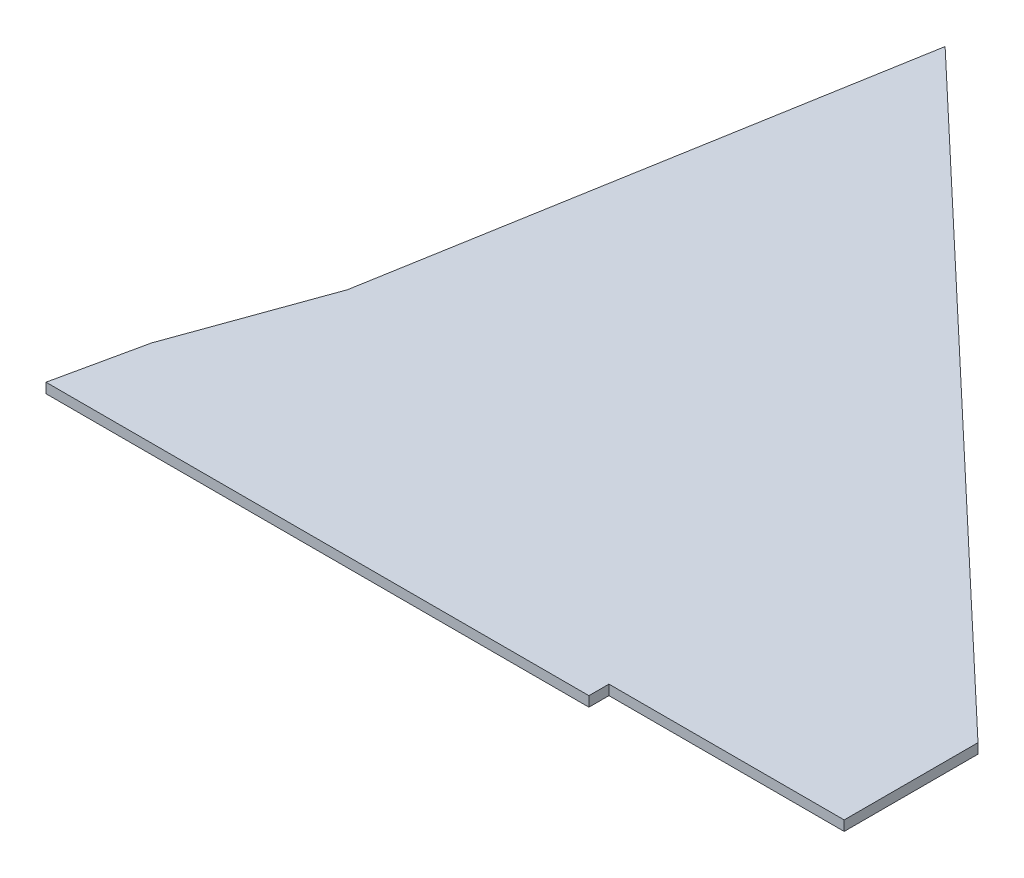
from build123d import *

# Parameters (mm, degrees)
EXTRUDE_2_DEPTH = 1
EXTRUDE_3_DEPTH = 0.2


with BuildPart() as part:
    # 草图1 → 凸台-拉伸2 (new body)
    with BuildSketch(Plane(origin=(0, 0, 0), x_dir=(1, 0, 0), z_dir=(0, 1, 0))):
        Polygon((0.666974339, -2.008736998), (62.551506128, -60.607239608), (62.551506128, -66.034908414), (62.551506128, -67.034908414), (62.551506128, -73.980545843), (39.045516138, -73.980545843), (39.045516138, -75.980545843), (-15.208783188, -75.980545843), (-13.317561286, -67.24653925), (-13.232104006, -67.034908414), (-12.872161474, -66.034908414), (-8.15025235, -52.916400008), align=None)
    extrude(amount=EXTRUDE_2_DEPTH)

    # 草图2 → 凸台-拉伸3 (add)
    # profile 1 of 5: a face of its own
    with BuildSketch(Plane.XZ):
        with BuildLine():
            Line((16.074632356, 56.916400008), (17.590866122, 56.916400008))
            add(Edge.make_bspline(
                [(17.590866122, 56.916400008), (17.648499995, 56.915875197), (17.759747413, 56.914862185), (17.920586306, 56.908759142), (18.068885312, 56.897038009), (18.206653748, 56.882921899), (18.336200791, 56.858115693), (18.459924614, 56.818759177), (18.578616773, 56.764956297), (18.691565149, 56.697511264), (18.796674333, 56.617289158), (18.888130253, 56.521122322), (18.966299174, 56.411973737), (19.028319344, 56.290438449), (19.077510823, 56.161810781), (19.1135732, 56.028909192), (19.135164995, 55.892755975), (19.138096413, 55.800945299), (19.139567421, 55.754874034)],
                knots=[0, 0, 0, 0, 1.244157682, 2.401527469, 3.473468824, 4.455130815, 5.389799171, 6.315206347, 7.251005401, 8.196559236, 9.149855764, 10.095824383, 11.0504261, 12.037874139, 13.032515979, 14.018598527, 15.005718329, 16, 16, 16, 16], degree=3))
            add(Edge.make_bspline(
                [(19.139567421, 55.754874034), (19.138547753, 55.709628614), (19.136549692, 55.62096924), (19.118813235, 55.491715961), (19.091882738, 55.368787174), (19.051654983, 55.253368308), (19.001161623, 55.144377841), (18.939293482, 55.042382161), (18.865381477, 54.94771844), (18.780990114, 54.859539474), (18.683688187, 54.779903763), (18.572291815, 54.711866589), (18.447832517, 54.654005487), (18.309784555, 54.60723217), (18.158146088, 54.570903332), (17.993045434, 54.545819174), (17.814704152, 54.528835116), (17.691287831, 54.527487377), (17.627392096, 54.526789618)],
                knots=[0, 0, 0, 0, 0.978177196, 1.916759246, 2.816858773, 3.695957288, 4.554717961, 5.410842432, 6.270061616, 7.147502833, 8.04596474, 8.981440044, 9.963234339, 11.008881904, 12.128796686, 13.33146493, 14.618432235, 16, 16, 16, 16], degree=3))
            Line((17.627392096, 54.526789618), (16.594112875, 54.526789618))
            Line((16.594112875, 54.526789618), (16.594112875, 52.916400008))
            Line((16.594112875, 52.916400008), (16.074632356, 52.916400008))
            Line((16.074632356, 52.916400008), (16.074632356, 56.916400008))
        make_face()
        with BuildLine():
            Line((16.594112875, 54.994322086), (17.650931057, 54.994322086))
            add(Edge.make_bspline(
                [(17.650931057, 54.994322086), (17.690172766, 54.995061361), (17.766036024, 54.99649055), (17.876167316, 55.004159305), (17.978355079, 55.018842231), (18.073507315, 55.03877464), (18.160686648, 55.06578506), (18.241235048, 55.096684456), (18.312817617, 55.135887532), (18.378661064, 55.177860376), (18.434924498, 55.228732153), (18.485001095, 55.283646875), (18.526862026, 55.345519566), (18.560622639, 55.413088849), (18.588087085, 55.486118776), (18.606105808, 55.565315304), (18.617782876, 55.650090448), (18.619304398, 55.708566601), (18.620086901, 55.738640268)],
                knots=[0, 0, 0, 0, 1.3506626, 2.611141784, 3.796285978, 4.901204962, 5.9527306, 6.934848657, 7.863795126, 8.757347314, 9.614903967, 10.465506862, 11.310023167, 12.176181001, 13.060025945, 13.98827215, 14.965389641, 16, 16, 16, 16], degree=3))
            add(Edge.make_bspline(
                [(18.620086901, 55.738640268), (18.618529753, 55.778259728), (18.615482558, 55.855791318), (18.591468075, 55.968436501), (18.551110872, 56.073679691), (18.496255375, 56.169934719), (18.431237857, 56.254919142), (18.356071863, 56.32257299), (18.274416141, 56.374244346), (18.181156898, 56.405995302), (18.074430539, 56.425089523), (17.949178007, 56.439604071), (17.801715925, 56.446811551), (17.696120516, 56.448150466), (17.639567421, 56.44886754)],
                knots=[0, 0, 0, 0, 1.018660659, 1.99342392, 2.947462538, 3.907551051, 4.834908788, 5.687573627, 6.497006468, 7.302839678, 8.203828931, 9.283092672, 10.544922364, 12, 12, 12, 12], degree=3))
            Line((17.639567421, 56.44886754), (16.594112875, 56.44886754))
            Line((16.594112875, 56.44886754), (16.594112875, 54.994322086))
        make_face(mode=Mode.SUBTRACT)
    # profile 2 of 5: a face of its own
    with BuildSketch(Plane.XZ):
        with BuildLine():
            Line((22.308398589, 52.916400008), (21.78891807, 52.916400008))
            add(Edge.make_bspline(
                [(21.78891807, 52.916400008), (21.771030564, 52.941612159), (21.734192084, 52.993535406), (21.693635699, 53.083848499), (21.656527825, 53.18292137), (21.641087617, 53.254335162), (21.633073914, 53.291400008)],
                knots=[0, 0, 0, 0, 0.903978496, 1.861701424, 2.890190454, 4, 4, 4, 4], degree=3))
            add(Edge.make_bspline(
                [(21.633073914, 53.291400008), (21.592778696, 53.257392964), (21.513514667, 53.190498291), (21.38712942, 53.104367919), (21.25968558, 53.028919474), (21.128130741, 52.970475054), (20.99532114, 52.922034952), (20.859397596, 52.88948097), (20.721160465, 52.86784696), (20.628015769, 52.865588757), (20.581125862, 52.864451956)],
                knots=[0, 0, 0, 0, 1.089286914, 2.142717553, 3.15767242, 4.14639824, 5.114065367, 6.075847107, 7.031363525, 8, 8, 8, 8], degree=3))
            add(Edge.make_bspline(
                [(20.581125862, 52.864451956), (20.544291352, 52.86487426), (20.472597394, 52.865696225), (20.368240679, 52.877883531), (20.269832252, 52.895063243), (20.17747491, 52.920422327), (20.090928869, 52.952787508), (20.010453779, 52.992942768), (19.934887287, 53.03887208), (19.867163958, 53.093579728), (19.805930348, 53.153443277), (19.753293609, 53.218993358), (19.70672904, 53.288102814), (19.670678414, 53.363297978), (19.642000507, 53.442416882), (19.621650322, 53.526218982), (19.609345029, 53.614624874), (19.607857301, 53.675288482), (19.607099888, 53.706172735)],
                knots=[0, 0, 0, 0, 1.216620172, 2.368005272, 3.467709852, 4.515474186, 5.528552914, 6.516295668, 7.48404396, 8.444826962, 9.386953838, 10.308660681, 11.218844643, 12.134633563, 13.056730693, 13.995797328, 14.979646845, 16, 16, 16, 16], degree=3))
            add(Edge.make_bspline(
                [(19.607099888, 53.706172735), (19.607839464, 53.735711316), (19.609297951, 53.793963185), (19.621988656, 53.878979729), (19.641089887, 53.96056233), (19.669748996, 54.037418373), (19.705890994, 54.110590268), (19.74953236, 54.179805691), (19.802506313, 54.244224819), (19.86249956, 54.305855294), (19.933563689, 54.362169995), (20.015053623, 54.414536401), (20.109325366, 54.460390215), (20.21502913, 54.501504264), (20.332261729, 54.537819715), (20.4610338, 54.56929687), (20.601389415, 54.596042543), (20.699288508, 54.609243212), (20.749957031, 54.616075333)],
                knots=[0, 0, 0, 0, 0.872498924, 1.720620716, 2.535170943, 3.344721347, 4.138600393, 4.943834853, 5.75681365, 6.59930027, 7.480948153, 8.430305917, 9.456622844, 10.573255699, 11.779617648, 13.080931191, 14.489210689, 16, 16, 16, 16], degree=3))
            Line((20.749957031, 54.616075333), (21.209372615, 54.685068839))
            add(Edge.make_bspline(
                [(21.209372615, 54.685068839), (21.250547073, 54.692111388), (21.32907039, 54.705542148), (21.441050463, 54.728941183), (21.541471868, 54.755043313), (21.603693773, 54.77643098), (21.633073914, 54.786529878)],
                knots=[0, 0, 0, 0, 1.148822433, 2.19090552, 3.145775892, 4, 4, 4, 4], degree=3))
            add(Edge.make_bspline(
                [(21.633073914, 54.786529878), (21.632934977, 54.818456822), (21.632678248, 54.877451699), (21.630483246, 54.958125896), (21.626471429, 55.02363098), (21.621428854, 55.076733695), (21.610971729, 55.123120141), (21.594719038, 55.167618414), (21.571402293, 55.212582094), (21.542451086, 55.257900887), (21.50598414, 55.302817154), (21.458165779, 55.342095595), (21.401262711, 55.377579684), (21.333904385, 55.407144656), (21.256404595, 55.432752348), (21.166726091, 55.450037701), (21.065142817, 55.460436695), (20.993221327, 55.461365182), (20.955314174, 55.461854553)],
                knots=[0, 0, 0, 0, 1.352390342, 2.498958307, 3.417589155, 4.132656031, 4.755438218, 5.426148164, 6.133458403, 6.896422909, 7.702008864, 8.57217888, 9.503941296, 10.534942635, 11.680192474, 12.954580022, 14.394871946, 16, 16, 16, 16], degree=3))
            add(Edge.make_bspline(
                [(20.955314174, 55.461854553), (20.907053085, 55.460936798), (20.815421145, 55.459194281), (20.686018879, 55.437433138), (20.571563657, 55.404611691), (20.48817737, 55.36293786), (20.429715782, 55.322129536), (20.390830711, 55.285119575), (20.355017195, 55.24260148), (20.322136918, 55.194447613), (20.294130216, 55.139616495), (20.269049247, 55.07933695), (20.246693655, 55.013295301), (20.236008897, 54.966568416), (20.230476512, 54.942374034)],
                knots=[0, 0, 0, 0, 1.754488428, 3.33119665, 4.761009267, 6.073287814, 6.701707133, 7.349574514, 8.020310045, 8.722196594, 9.466521309, 10.256534016, 11.097263129, 12, 12, 12, 12], degree=3))
            Line((20.230476512, 54.942374034), (19.710995992, 55.004062346))
            add(Edge.make_bspline(
                [(19.710995992, 55.004062346), (19.71814806, 55.039409898), (19.732126502, 55.108495334), (19.764516007, 55.207559439), (19.803971866, 55.300049151), (19.851244306, 55.385740072), (19.905957901, 55.464814111), (19.969749004, 55.536128334), (20.040715114, 55.601356029), (20.118978933, 55.660341322), (20.205807552, 55.71145347), (20.300206181, 55.755903657), (20.402140504, 55.79434918), (20.511927225, 55.82489768), (20.629465303, 55.848253066), (20.754445715, 55.864952926), (20.88720671, 55.875948252), (20.978288922, 55.876932772), (21.025119369, 55.877438969)],
                knots=[0, 0, 0, 0, 0.995121737, 1.944927317, 2.871981718, 3.768176624, 4.642811287, 5.521362031, 6.404380574, 7.300917974, 8.222174075, 9.181307321, 10.17903391, 11.226833696, 12.324278523, 13.485482902, 14.707146475, 16, 16, 16, 16], degree=3))
            add(Edge.make_bspline(
                [(21.025119369, 55.877438969), (21.067337501, 55.877001586), (21.148865094, 55.876156953), (21.266977822, 55.868856268), (21.376099444, 55.856677667), (21.476861227, 55.841025486), (21.568787371, 55.819027373), (21.652108288, 55.792508915), (21.727284989, 55.761903418), (21.793129276, 55.724961322), (21.851574017, 55.684626578), (21.904977231, 55.64372469), (21.951072568, 55.599104239), (21.993009313, 55.554503682), (22.027215377, 55.506243173), (22.056991096, 55.457013761), (22.079583437, 55.404707182), (22.102591792, 55.330623309), (22.1231648, 55.229129066), (22.140676346, 55.095962994), (22.151092143, 54.947137727), (22.15205159, 54.842823812), (22.152554434, 54.788153255)],
                knots=[0, 0, 0, 0, 1.367973647, 2.641699044, 3.83258734, 4.925145554, 5.943754658, 6.892017319, 7.756622128, 8.569019077, 9.332592202, 10.056954743, 10.745352397, 11.409424547, 12.037261465, 12.658266172, 13.270733256, 13.877969521, 15.169404919, 16.620144845, 18.228629769, 20, 20, 20, 20], degree=3))
            Line((22.152554434, 54.788153255), (22.152554434, 54.128250657))
            add(Edge.make_bspline(
                [(22.152554434, 54.128250657), (22.152386767, 54.080089401), (22.152065552, 53.987822103), (22.154247902, 53.855794563), (22.155497043, 53.735924457), (22.15797884, 53.628507877), (22.16095625, 53.533518387), (22.165448205, 53.451030167), (22.168730128, 53.380850668), (22.176350975, 53.303760791), (22.190656278, 53.215868085), (22.218342154, 53.114040763), (22.257560119, 53.013489566), (22.291269672, 52.949112225), (22.308398589, 52.916400008)],
                knots=[0, 0, 0, 0, 1.402077777, 2.686099577, 3.844102432, 4.89198882, 5.814117699, 6.610652945, 7.297068948, 7.859036182, 8.865208258, 9.885586107, 10.925597672, 12, 12, 12, 12], degree=3))
        make_face()
        with BuildLine():
            Line((21.633073914, 54.199679229), (21.633073914, 54.370945463))
            add(Edge.make_bspline(
                [(21.633073914, 54.370945463), (21.565097125, 54.350685467), (21.423129309, 54.308372976), (21.196480278, 54.258056168), (20.949009568, 54.210469211), (20.73183316, 54.182862064), (20.559356381, 54.156119691), (20.444759329, 54.123793907), (20.346891472, 54.0822163), (20.266163952, 54.03013413), (20.203298982, 53.967095182), (20.158371182, 53.89412008), (20.131264065, 53.810825256), (20.128181927, 53.752106065), (20.126580408, 53.721594813)],
                knots=[0, 0, 0, 0, 1.446121226, 3.020187841, 4.732247023, 6.583196503, 7.48489336, 8.288294041, 9.004862088, 9.646088731, 10.235252101, 10.804947704, 11.379035372, 12, 12, 12, 12], degree=3))
            add(Edge.make_bspline(
                [(20.126580408, 53.721594813), (20.128354619, 53.690768955), (20.131812524, 53.630689936), (20.162066573, 53.545176061), (20.210040572, 53.468260465), (20.27699432, 53.401060111), (20.361923167, 53.346008152), (20.464383491, 53.307839801), (20.582482073, 53.284068767), (20.666497505, 53.281432606), (20.710995992, 53.280036372)],
                knots=[0, 0, 0, 0, 0.897954492, 1.750096425, 2.616193338, 3.526990211, 4.497948252, 5.548655872, 6.701653948, 8, 8, 8, 8], degree=3))
            add(Edge.make_bspline(
                [(20.710995992, 53.280036372), (20.741056313, 53.280635612), (20.800256445, 53.281815742), (20.88763768, 53.291908195), (20.972343482, 53.30802532), (21.054548839, 53.330941083), (21.134435027, 53.359785666), (21.21073948, 53.397042597), (21.284867823, 53.439049376), (21.355760255, 53.487442934), (21.421515628, 53.544136052), (21.478180082, 53.611216711), (21.526978502, 53.686863023), (21.565462514, 53.772178638), (21.596650638, 53.866218244), (21.617902799, 53.969455692), (21.631201286, 54.081634612), (21.632433741, 54.159324738), (21.633073914, 54.199679229)],
                knots=[0, 0, 0, 0, 0.974054159, 1.91828078, 2.847027565, 3.766160553, 4.68173059, 5.595661213, 6.514794201, 7.441593013, 8.373811142, 9.319299364, 10.277753641, 11.282242768, 12.344374973, 13.483001631, 14.692598504, 16, 16, 16, 16], degree=3))
        make_face(mode=Mode.SUBTRACT)
    # profile 3 of 5: a face of its own
    with BuildSketch(Plane.XZ):
        with BuildLine():
            Line((24.438268719, 55.71834806), (24.276742745, 55.254062346))
            add(Edge.make_bspline(
                [(24.276742745, 55.254062346), (24.248157403, 55.269982907), (24.19275538, 55.300838978), (24.1058555, 55.333239539), (24.019883986, 55.354082358), (23.962461162, 55.356680309), (23.934210278, 55.35795845)],
                knots=[0, 0, 0, 0, 1.082931093, 2.098857996, 3.064676051, 4, 4, 4, 4], degree=3))
            add(Edge.make_bspline(
                [(23.934210278, 55.35795845), (23.912778255, 55.357171587), (23.870955348, 55.355636086), (23.810407421, 55.343867818), (23.753730247, 55.325664004), (23.701596755, 55.297743806), (23.652937225, 55.263185185), (23.608815228, 55.220151559), (23.568579697, 55.170106332), (23.533348053, 55.112232152), (23.501628863, 55.04782751), (23.474191859, 54.976880882), (23.450715407, 54.900136835), (23.432359437, 54.816980883), (23.416734948, 54.728229012), (23.406332788, 54.63279592), (23.401066024, 54.53144947), (23.399904091, 54.461859994), (23.39930768, 54.426140268)],
                knots=[0, 0, 0, 0, 0.855831978, 1.670088837, 2.45644836, 3.225371139, 4.023460862, 4.833976638, 5.679917449, 6.583000468, 7.535533694, 8.545428253, 9.619328321, 10.739264245, 11.946160008, 13.218911436, 14.572489276, 16, 16, 16, 16], degree=3))
            Line((23.39930768, 54.426140268), (23.39930768, 52.916400008))
            Line((23.39930768, 52.916400008), (22.879827161, 52.916400008))
            Line((22.879827161, 52.916400008), (22.879827161, 55.825490917))
            Line((22.879827161, 55.825490917), (23.347359628, 55.825490917))
            Line((23.347359628, 55.825490917), (23.347359628, 55.375003904))
            Line((23.347359628, 55.375003904), (23.357911576, 55.375003904))
            add(Edge.make_bspline(
                [(23.357911576, 55.375003904), (23.376627291, 55.414638538), (23.412474584, 55.490553048), (23.47595768, 55.593066118), (23.543388749, 55.680548557), (23.616015298, 55.751883402), (23.692722478, 55.808409789), (23.774691748, 55.848062281), (23.861092212, 55.872706415), (23.920522626, 55.87585417), (23.950444044, 55.877438969)],
                knots=[0, 0, 0, 0, 1.276506557, 2.444966941, 3.506508087, 4.487857198, 5.402644978, 6.270166428, 7.129081051, 8, 8, 8, 8], degree=3))
            add(Edge.make_bspline(
                [(23.950444044, 55.877438969), (23.991221168, 55.875605794), (24.073863873, 55.871890511), (24.196750909, 55.839535198), (24.320283859, 55.790073148), (24.398026161, 55.742812224), (24.438268719, 55.71834806)],
                knots=[0, 0, 0, 0, 0.939501361, 1.904080694, 2.915067448, 4, 4, 4, 4], degree=3))
        make_face()
    # profile 4 of 5: a face of its own
    with BuildSketch(Plane.XZ):
        with BuildLine():
            add(Edge.make_bspline(
                [(25.892814174, 52.906659748), (25.858236082, 52.900100275), (25.792260136, 52.88758462), (25.696866428, 52.874915861), (25.609980334, 52.86585699), (25.554630843, 52.864904118), (25.528366122, 52.864451956)],
                knots=[0, 0, 0, 0, 1.149228166, 2.192758784, 3.142418744, 4, 4, 4, 4], degree=3))
            add(Edge.make_bspline(
                [(25.528366122, 52.864451956), (25.502649577, 52.864661083), (25.453041438, 52.865064496), (25.381521362, 52.871006937), (25.315374588, 52.879780578), (25.254603093, 52.891815814), (25.198756681, 52.907000436), (25.148576116, 52.926545681), (25.103196916, 52.948928932), (25.052276659, 52.984789803), (24.997086722, 53.034463257), (24.945193278, 53.103896178), (24.907052727, 53.180609314), (24.883410208, 53.266934162), (24.871543933, 53.365044254), (24.860347706, 53.477586622), (24.855576407, 53.607381778), (24.854451663, 53.699408739), (24.853853135, 53.748380527)],
                knots=[0, 0, 0, 0, 0.937266869, 1.808021469, 2.614321497, 3.368755705, 4.065183379, 4.720957953, 5.329721901, 5.904281876, 6.986469516, 8.022166564, 9.045578449, 10.09155794, 11.267501064, 12.644549952, 14.21441035, 16, 16, 16, 16], degree=3))
            Line((24.853853135, 53.748380527), (24.853853135, 55.409906501))
            Line((24.853853135, 55.409906501), (24.490216771, 55.409906501))
            Line((24.490216771, 55.409906501), (24.490216771, 55.825490917))
            Line((24.490216771, 55.825490917), (24.853853135, 55.825490917))
            Line((24.853853135, 55.825490917), (24.853853135, 56.560880527))
            Line((24.853853135, 56.560880527), (25.373333654, 56.864451956))
            Line((25.373333654, 56.864451956), (25.373333654, 55.825490917))
            Line((25.373333654, 55.825490917), (25.840866122, 55.825490917))
            Line((25.840866122, 55.825490917), (25.840866122, 55.409906501))
            Line((25.840866122, 55.409906501), (25.373333654, 55.409906501))
            Line((25.373333654, 55.409906501), (25.373333654, 53.729711696))
            add(Edge.make_bspline(
                [(25.373333654, 53.729711696), (25.37364331, 53.696147487), (25.374213797, 53.634311088), (25.382047066, 53.549272244), (25.394867463, 53.479986237), (25.410842933, 53.42307185), (25.44223682, 53.378773602), (25.491080526, 53.350938533), (25.553787939, 53.334302525), (25.600745677, 53.33280714), (25.626580408, 53.331984424)],
                knots=[0, 0, 0, 0, 1.452448426, 2.675891406, 3.688710307, 4.503367039, 5.215361632, 5.972529288, 6.88454679, 8, 8, 8, 8], degree=3))
            add(Edge.make_bspline(
                [(25.626580408, 53.331984424), (25.660130191, 53.331984424), (25.727770884, 53.331984424), (25.795411576, 53.331984424), (25.829502486, 53.331984424)],
                knots=[0, 0, 0, 0, 0.992, 2, 2, 2, 2], degree=3))
            Line((25.829502486, 53.331984424), (25.892814174, 52.906659748))
        make_face()
    # profile 5 of 5: a face of its own
    with BuildSketch(Plane.XZ):
        with BuildLine():
            Line((29.633073914, 52.916400008), (29.113593395, 52.916400008))
            Line((29.113593395, 52.916400008), (29.113593395, 56.085231177))
            add(Edge.make_bspline(
                [(29.113593395, 56.085231177), (29.081716476, 56.057245579), (29.017052353, 56.00047522), (28.912580599, 55.921334762), (28.801450713, 55.844447644), (28.681095613, 55.772790522), (28.554270595, 55.70160433), (28.418357294, 55.635692429), (28.275535757, 55.572017893), (28.176798542, 55.533429045), (28.126580408, 55.513802605)],
                knots=[0, 0, 0, 0, 0.887227992, 1.799791883, 2.740317713, 3.713084143, 4.729160018, 5.782325151, 6.872081878, 8, 8, 8, 8], degree=3))
            Line((28.126580408, 55.513802605), (28.126580408, 55.981335073))
            add(Edge.make_bspline(
                [(28.126580408, 55.981335073), (28.197105553, 56.014540063), (28.334509253, 56.07923314), (28.527604195, 56.188389827), (28.704054577, 56.302707521), (28.86237623, 56.423636759), (29.004211142, 56.549738638), (29.127834679, 56.682289599), (29.235293415, 56.820593119), (29.292928484, 56.919508787), (29.321385602, 56.96834806)],
                knots=[0, 0, 0, 0, 1.186256745, 2.31117662, 3.373566154, 4.384317168, 5.340991231, 6.258927164, 7.140351252, 8, 8, 8, 8], degree=3))
            Line((29.321385602, 56.96834806), (29.633073914, 56.96834806))
            Line((29.633073914, 56.96834806), (29.633073914, 52.916400008))
        make_face()
    extrude(amount=EXTRUDE_3_DEPTH)


solid = part.part
